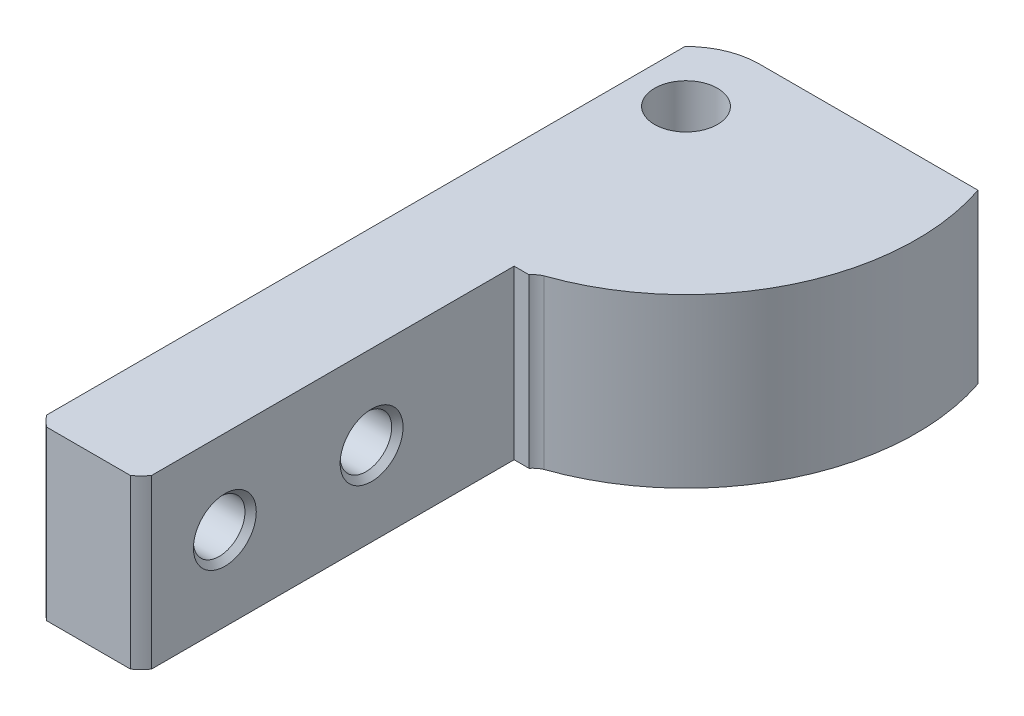
from build123d import *

# Parameters (mm, degrees)
EXTRUDE_1_DEPTH        = 8
HOLE_WIZARD_M2_1_D     = 2.459
HOLE_WIZARD_M2_1_DEPTH = 13.499999938
HOLE_WIZARD_M2_2_D     = 2.459
HOLE_WIZARD_3_0_3_1_D  = 3
CHAMFER_1_SIZE         = 0.2705


with BuildPart() as part:
    # 草图1 → 凸台-拉伸1 (new body)
    with BuildSketch(Plane(origin=(0, 4, 0), x_dir=(1, 0, 0), z_dir=(0, 1, 0))):
        with BuildLine():
            Line((-2.499999938, 2.449489682), (-2.499999938, -28.00000006))
            ThreePointArc((-2.499999938, -28.00000006), (-2.267766887, -28.267767018), (-1.999999928, -28.500000068))
            Line((-1.999999928, -28.500000068), (2.000000062, -28.500000068))
            ThreePointArc((2.000000062, -28.500000068), (2.267767019, -28.267767016), (2.500000069, -28.000000058))
            Line((2.500000069, -28.000000058), (2.500000069, -10.7))
            Line((2.500000069, -10.7), (3.21, -10.7))
            ThreePointArc((3.21, -10.7), (3.393052661, -10.517652269), (3.616779061, -10.388402631))
            ThreePointArc((3.616779061, -10.388402631), (9.876142021, -4.843740163), (10.428326836, 3.499999914))
            Line((10.428326836, 3.499999914), (0, 3.499999914))
            ThreePointArc((0, 3.499999914), (-1.355873467, 3.226702114), (-2.499999938, 2.449489682))
        make_face()
    extrude(amount=-EXTRUDE_1_DEPTH)

    # M2 间隙孔1
    with Locations(Plane.ZY.offset(2.499999938)):
        with Locations((17.5, 0)):
            Hole(HOLE_WIZARD_M2_1_D / 2, depth=HOLE_WIZARD_M2_1_DEPTH)

    # M2 间隙孔2 (through all)
    with Locations(Plane(origin=(2.500000069, 0, 0), x_dir=(0, 0, -1), z_dir=(1, 0, 0))):
        with Locations((-24.500000001, 0)):
            Hole(HOLE_WIZARD_M2_2_D / 2)

    # Ø3.0 (3) 直径孔1 (through all)
    with Locations(Plane(origin=(0, 4, 0), x_dir=(1, 0, 0), z_dir=(0, 1, 0))):
        with Locations((0, 0)):
            Hole(HOLE_WIZARD_3_0_3_1_D / 2)

    # 倒角1
    chamfer_1_edges = [part.edges().sort_by_distance(p)[0] for p in [
        (2.500000069, 0, 18.7295),
        (-2.499999938, 0, 18.7295),
        (2.500000069, 0, 23.270500001),
        (-2.499999938, 0, 23.270500001),
    ]]
    chamfer(chamfer_1_edges, length=CHAMFER_1_SIZE)


solid = part.part
